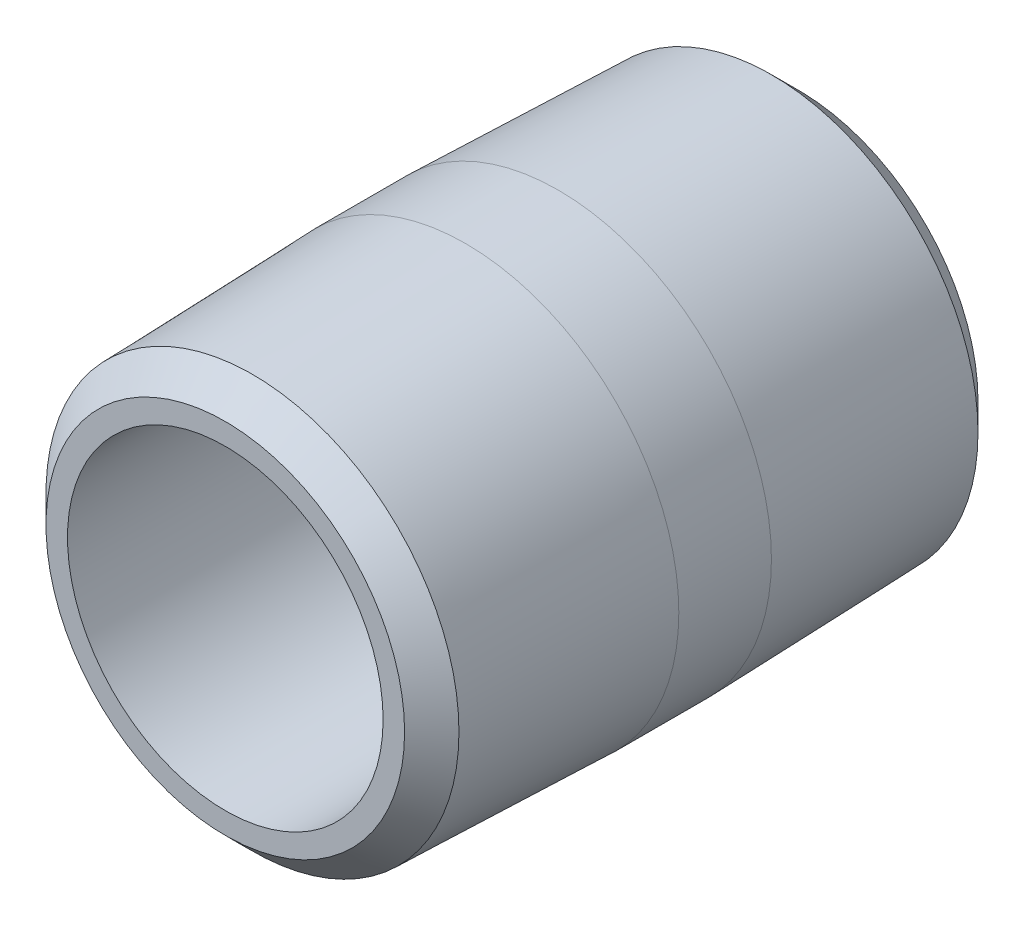
from build123d import *


with BuildPart() as part:
    # Sketch1 → Revolve1 (revolve)
    with BuildSketch(Plane(origin=(0, 0, 0), x_dir=(0, 0, -1), z_dir=(1, 0, 0))):
        Polygon((-14.351, 7.8994), (-14.351, 8.97499532), (-12.990285714, 10.335709606), (-2.31775, 10.668), (2.31775, 10.668), (12.990285714, 10.335709606), (14.351, 8.97499532), (14.351, 7.8994), align=None)
    revolve(axis=Axis((0, 0, 14.351), (0, 0, -1)))


solid = part.part
